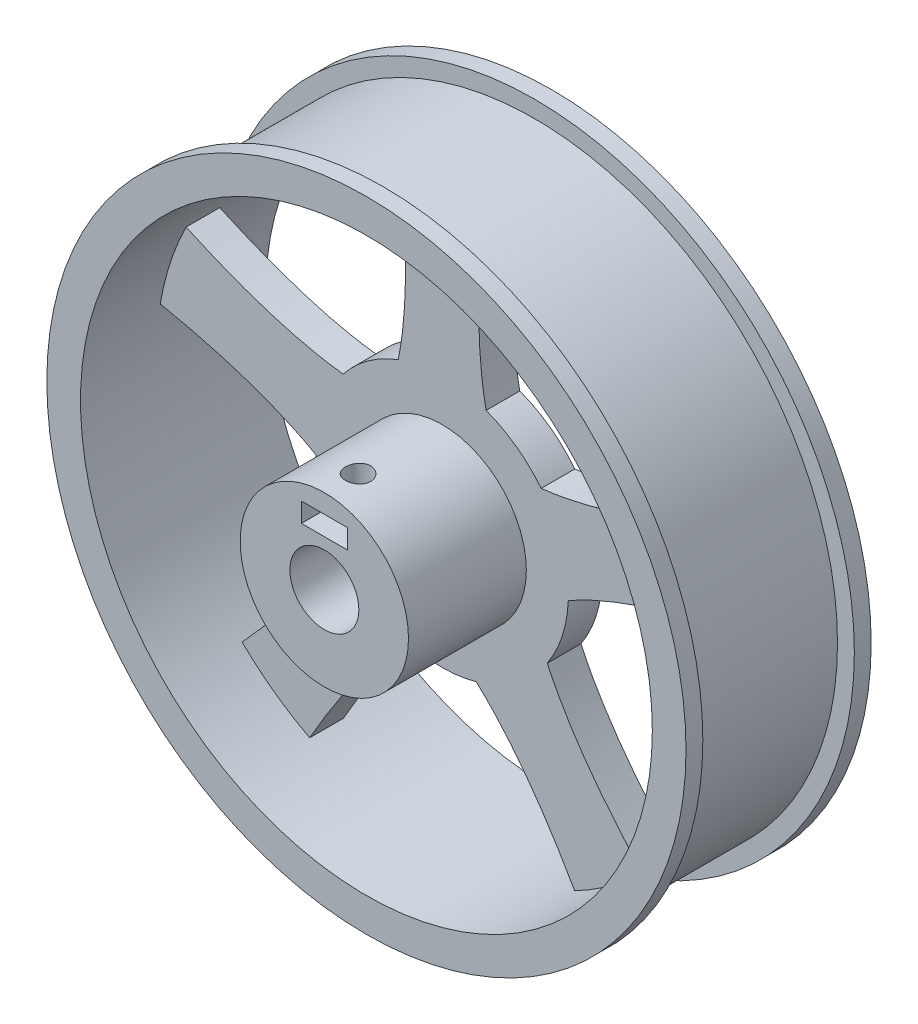
from build123d import *

# Parameters (mm, degrees)
BOSS_EXTRUDE1_DEPTH      = 2
BOSS_EXTRUDE1_DEPTH_BACK = 2
SKETCH3_R                = 15
BOSS_EXTRUDE3_DEPTH      = 2
BOSS_EXTRUDE3_DEPTH_BACK = 2
SKETCH12_R               = 10
BOSS_EXTRUDE4_DEPTH      = 16
CUT_EXTRUDE1_DEPTH       = 57.031941152
CUT_EXTRUDE1_DEPTH_BACK  = 57.031941152
SKETCH7_R                = 4.1
SKETCH13_W               = 5.45
SKETCH13_H               = 2.3
CUT_EXTRUDE2_DEPTH       = 4
CUT_EXTRUDE3_DEPTH       = 6
CUT_EXTRUDE3_DEPTH_BACK  = 4
SKETCH14_R               = 1.5
CUT_EXTRUDE4_DEPTH       = 2.3


with BuildPart() as part:
    # Sketch2 → Revolve1 (revolve)
    with BuildSketch(Plane(origin=(0, 0, 0), x_dir=(0, 0, -1), z_dir=(1, 0, 0)), mode=Mode.PRIVATE) as revolve1_sk:
        Polygon((-9, 35.970899576), (9, 35.970899576), (9, 37.970899576), (11, 37.970899576), (11, 33.970899576), (-11, 33.970899576), (-11, 37.970899576), (-9, 37.970899576), align=None)
    revolve(revolve1_sk.sketch.rotate(Axis((0, 0, 10), (0, 0, -1)), 90), axis=Axis((0, 0, 10), (0, 0, -1)))



with BuildPart() as body_2:
    # Sketch3 → Boss-Extrude1 (new, two sides: drawn at the far end of the back side and taken through both)
    with BuildSketch(Plane.XY.offset(-BOSS_EXTRUDE1_DEPTH_BACK)):
        Circle(SKETCH3_R)
    extrude(amount=BOSS_EXTRUDE1_DEPTH + BOSS_EXTRUDE1_DEPTH_BACK)


with BuildPart() as part_1:
    add(part.part)

    add(body_2.part)  # Boss-Extrude3 merges body 2
    # Sketch11 → Boss-Extrude3 (add, two sides: drawn at the far end of the back side and taken through both)
    with BuildSketch(Plane.XY.offset(-BOSS_EXTRUDE3_DEPTH_BACK)):
        with BuildLine():
            Line((5, 33.970899576), (-5, 33.970899576))
            add(Edge.make_bspline(
                [(-5, 33.970899576), (-3.602966052, 22.002598894), (-5.219370498, 14.062651656)],
                knots=[0, 0, 0, 0.277878322, 0.277878322, 0.277878322], degree=2))
            add(Edge.make_bspline(
                [(-5.219370498, 14.062651656), (-3.623415853, 14.571458155), (-2.092021841, 14.791258924)],
                knots=[0, 0, 0, 0.220994238, 0.220994238, 0.220994238], degree=2))
            add(Edge.make_bspline(
                [(-2.092021841, 14.791258924), (0.275566205, 15.158843416), (2.712697031, 14.915974307), (5.219370636, 14.062651605)],
                knots=[0.31222072, 0.31222072, 0.31222072, 0.31222072, 0.753229942, 0.753229942, 0.753229942, 0.753229942], degree=3))
            add(Edge.make_bspline(
                [(5, 33.970899576), (3.602966194, 22.002598839), (5.219370636, 14.062651605)],
                knots=[0, 0, 0, 0.277878321, 0.277878321, 0.277878321], degree=2))
        make_face()
        with BuildLine():
            Line((33.853330378, 5.742302702), (30.763160434, 15.252867865))
            add(Edge.make_bspline(
                [(30.763160434, 15.252867865), (19.812337313, 10.225801321), (11.76150231, 9.309514671)],
                knots=[0, 0, 0, 0.277878322, 0.277878322, 0.277878322], degree=2))
            add(Edge.make_bspline(
                [(11.76150231, 9.309514671), (12.738583154, 7.948901461), (13.420852883, 6.56038138)],
                knots=[0, 0, 0, 0.220994238, 0.220994238, 0.220994238], degree=2))
            add(Edge.make_bspline(
                [(13.420852883, 6.56038138), (14.50207145, 4.422261196), (15.024204045, 2.029361361), (14.987250672, -0.618318123)],
                knots=[0.31222072, 0.31222072, 0.31222072, 0.31222072, 0.753229942, 0.753229942, 0.753229942, 0.753229942], degree=3))
            add(Edge.make_bspline(
                [(33.853330378, 5.742302702), (22.039092786, 3.372552484), (14.987250672, -0.618318123)],
                knots=[0, 0, 0, 0.277878321, 0.277878321, 0.277878321], degree=2))
        make_face()
        with BuildLine():
            Line((15.922508806, -30.421961333), (24.01267875, -24.54410881))
            add(Edge.make_bspline(
                [(24.01267875, -24.54410881), (15.847663908, -15.682706115), (12.488378684, -8.309055171)],
                knots=[0, 0, 0, 0.277878322, 0.277878322, 0.277878322], degree=2))
            add(Edge.make_bspline(
                [(12.488378684, -8.309055171), (11.496293211, -9.658766879), (10.386565081, -10.736720252)],
                knots=[0, 0, 0, 0.220994238, 0.220994238, 0.220994238], degree=2))
            add(Edge.make_bspline(
                [(10.386565081, -10.736720252), (8.687206859, -12.42573569), (6.572771723, -13.661760011), (4.043259677, -14.444793221)],
                knots=[0.31222072, 0.31222072, 0.31222072, 0.31222072, 0.753229942, 0.753229942, 0.753229942, 0.753229942], degree=3))
            add(Edge.make_bspline(
                [(15.922508806, -30.421961333), (10.017942228, -19.918246775), (4.043259677, -14.444793221)],
                knots=[0, 0, 0, 0.277878321, 0.277878321, 0.277878321], degree=2))
        make_face()
        with BuildLine():
            Line((-24.01267875, -24.54410881), (-15.922508806, -30.421961333))
            add(Edge.make_bspline(
                [(-15.922508806, -30.421961333), (-10.017942375, -19.918246736), (-4.043259819, -14.444793181)],
                knots=[0, 0, 0, 0.277878322, 0.277878322, 0.277878322], degree=2))
            add(Edge.make_bspline(
                [(-4.043259819, -14.444793181), (-5.633483205, -13.918347682), (-7.001602636, -13.196039424)],
                knots=[0, 0, 0, 0.220994238, 0.220994238, 0.220994238], degree=2))
            add(Edge.make_bspline(
                [(-7.001602636, -13.196039424), (-9.133082344, -12.101788187), (-10.96200772, -10.472793393), (-12.488378766, -8.309055048)],
                knots=[0.31222072, 0.31222072, 0.31222072, 0.31222072, 0.753229942, 0.753229942, 0.753229942, 0.753229942], degree=3))
            add(Edge.make_bspline(
                [(-24.01267875, -24.54410881), (-15.847663991, -15.682705988), (-12.488378766, -8.309055048)],
                knots=[0, 0, 0, 0.277878321, 0.277878321, 0.277878321], degree=2))
        make_face()
        with BuildLine():
            Line((-30.763160434, 15.252867865), (-33.853330378, 5.742302702))
            add(Edge.make_bspline(
                [(-33.853330378, 5.742302702), (-22.039092794, 3.372552636), (-14.987250678, -0.618317975)],
                knots=[0, 0, 0, 0.277878322, 0.277878322, 0.277878322], degree=2))
            add(Edge.make_bspline(
                [(-14.987250678, -0.618317975), (-14.977977306, 1.056754944), (-14.713793486, 2.581119372)],
                knots=[0, 0, 0, 0.220994238, 0.220994238, 0.220994238], degree=2))
            add(Edge.make_bspline(
                [(-14.713793486, 2.581119372), (-14.33176217, 4.946419265), (-13.347665078, 7.189217736), (-11.761502219, 9.309514786)],
                knots=[0.31222072, 0.31222072, 0.31222072, 0.31222072, 0.753229942, 0.753229942, 0.753229942, 0.753229942], degree=3))
            add(Edge.make_bspline(
                [(-30.763160434, 15.252867865), (-19.812337217, 10.225801439), (-11.761502219, 9.309514786)],
                knots=[0, 0, 0, 0.277878321, 0.277878321, 0.277878321], degree=2))
        make_face()
    extrude(amount=BOSS_EXTRUDE3_DEPTH + BOSS_EXTRUDE3_DEPTH_BACK)

    # Sketch12 → Boss-Extrude4 (add)
    with BuildSketch(Plane.XY):
        Circle(SKETCH12_R)
    extrude(amount=BOSS_EXTRUDE4_DEPTH)

    # Sketch7 → Cut-Extrude1 (cut, two sides: drawn at the far end of the back side and taken through both)
    with BuildSketch(Plane.XY.offset(-CUT_EXTRUDE1_DEPTH_BACK)):
        Circle(SKETCH7_R)
    extrude(amount=CUT_EXTRUDE1_DEPTH + CUT_EXTRUDE1_DEPTH_BACK, mode=Mode.SUBTRACT)

    # Sketch13 → Cut-Extrude2 (cut)
    with BuildSketch(Plane.XY.offset(16)):
        with Locations((0, 6.614053633)):
            Rectangle(SKETCH13_W, SKETCH13_H)
    extrude(amount=-CUT_EXTRUDE2_DEPTH, mode=Mode.SUBTRACT)

    # Sketch14 → Cut-Extrude3 (cut, two sides: drawn at the far end of the back side and taken through both)
    with BuildSketch(Plane(origin=(0, 5.464053633, 0), x_dir=(1, 0, 0), z_dir=(0, 1, 0)).offset(-CUT_EXTRUDE3_DEPTH_BACK)):
        with Locations((0, -12)):
            Circle(SKETCH14_R)
    extrude(amount=CUT_EXTRUDE3_DEPTH + CUT_EXTRUDE3_DEPTH_BACK, mode=Mode.SUBTRACT)

    # Sketch16 → Cut-Extrude4 (cut)
    with BuildSketch(Plane(origin=(0, 5.464053633, 0), x_dir=(1, 0, 0), z_dir=(0, 1, 0))):
        Polygon((0, -15.124596023), (2.705979533, -13.562298012), (2.705979533, -10.437701988), (0, -8.875403977), (-2.705979533, -10.437701988), (-2.705979533, -13.562298012), align=None)
    extrude(amount=CUT_EXTRUDE4_DEPTH, mode=Mode.SUBTRACT)


solid = part_1.part
